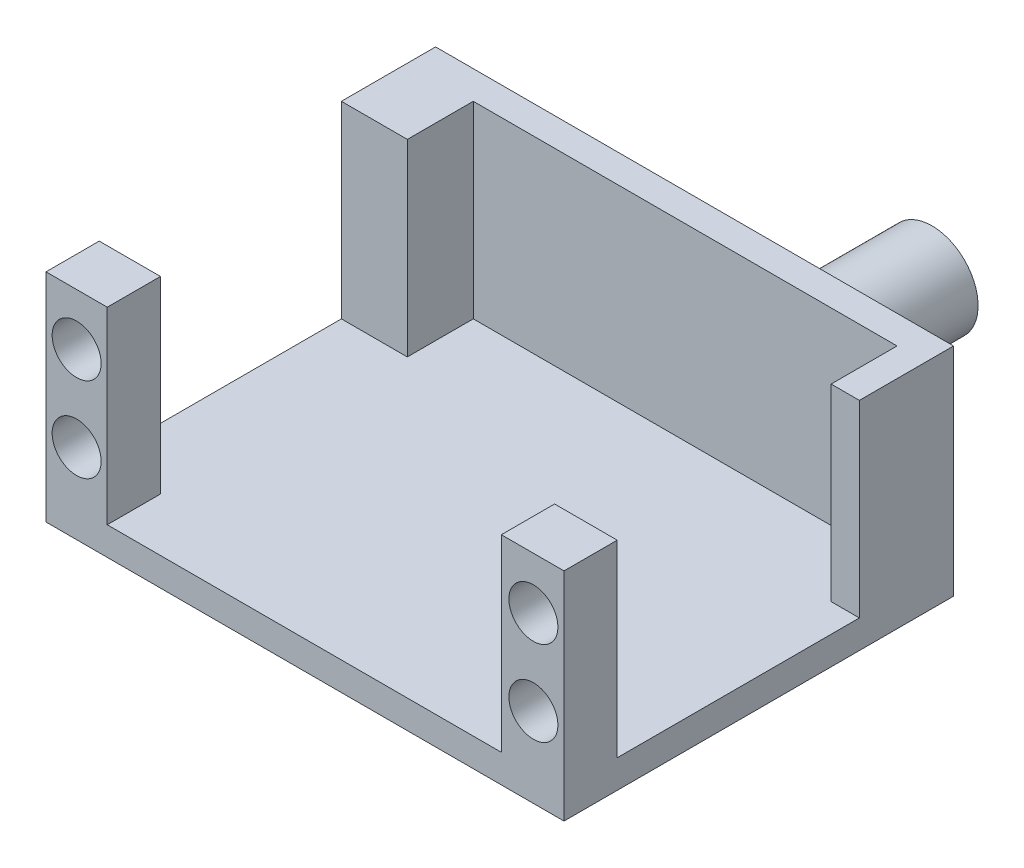
from build123d import *

# Parameters (mm, degrees)
SKETCH1_W           = 54.98
SKETCH1_H           = 41.35
BOSS_EXTRUDE1_DEPTH = 3
SKETCH2_W           = 6.5
SKETCH2_H           = 5.65
SKETCH2_W_2         = 6.65
BOSS_EXTRUDE2_DEPTH = 20
SKETCH3_R           = 4.9
BOSS_EXTRUDE3_DEPTH = 15
CUT_EXTRUDE1_REACH  = 68.783
SKETCH4_R           = 2.6


with BuildPart() as part:
    # Sketch1 → Boss-Extrude1 (new body)
    with BuildSketch(Plane(origin=(0, 0, 0), x_dir=(1, 0, 0), z_dir=(0, 1, 0))):
        with Locations((0, -3)):
            Rectangle(SKETCH1_W, SKETCH1_H)
    extrude(amount=BOSS_EXTRUDE1_DEPTH)

    # Sketch2 → Boss-Extrude2 (add)
    with BuildSketch(Plane(origin=(0, 3, 0), x_dir=(1, 0, 0), z_dir=(0, 1, 0))):
        with Locations((-24.24, -20.85)):
            Rectangle(SKETCH2_W, SKETCH2_H)
        with Locations((24.165, -20.85)):
            Rectangle(SKETCH2_W_2, SKETCH2_H)
        Polygon((-27.49, 17.675), (27.49, 17.675), (27.49, 7.675), (24.49, 7.675), (24.49, 14.675), (-20.49, 14.675), (-20.49, 7.675), (-27.49, 7.675), align=None)
    extrude(amount=BOSS_EXTRUDE2_DEPTH)

    # Sketch3 → Boss-Extrude3 (add)
    with BuildSketch(Plane(origin=(0, 0, -17.675), x_dir=(-1, 0, 0), z_dir=(0, 0, -1))):
        with Locations((-10.19, 13)):
            Circle(SKETCH3_R)
    extrude(amount=BOSS_EXTRUDE3_DEPTH)

    # Sketch4 → Cut-Extrude1 (cut, up to next)
    with BuildSketch(Plane.XY.offset(23.675), mode=Mode.PRIVATE) as cut_extrude1_sk1:
        with Locations((-24.24, 17.5)):
            Circle(SKETCH4_R)
    cut_extrude1_tool1 = extrude(cut_extrude1_sk1.sketch, amount=-CUT_EXTRUDE1_REACH, mode=Mode.PRIVATE) & part.part
    # Sketch4 → Cut-Extrude1 (cut, up to next)
    with BuildSketch(Plane.XY.offset(23.675), mode=Mode.PRIVATE) as cut_extrude1_sk2:
        with Locations((-24.24, 8.5)):
            Circle(SKETCH4_R)
    cut_extrude1_tool2 = extrude(cut_extrude1_sk2.sketch, amount=-CUT_EXTRUDE1_REACH, mode=Mode.PRIVATE) & part.part
    # Sketch4 → Cut-Extrude1 (cut, up to next)
    with BuildSketch(Plane.XY.offset(23.675), mode=Mode.PRIVATE) as cut_extrude1_sk3:
        with Locations((24.24, 17.5)):
            Circle(SKETCH4_R)
    cut_extrude1_tool3 = extrude(cut_extrude1_sk3.sketch, amount=-CUT_EXTRUDE1_REACH, mode=Mode.PRIVATE) & part.part
    # Sketch4 → Cut-Extrude1 (cut, up to next)
    with BuildSketch(Plane.XY.offset(23.675), mode=Mode.PRIVATE) as cut_extrude1_sk4:
        with Locations((24.24, 8.5)):
            Circle(SKETCH4_R)
    cut_extrude1_tool4 = extrude(cut_extrude1_sk4.sketch, amount=-CUT_EXTRUDE1_REACH, mode=Mode.PRIVATE) & part.part
    add(cut_extrude1_tool1.solids().sort_by_distance((-24.24, 17.5, 23.675))[0], mode=Mode.SUBTRACT)
    add(cut_extrude1_tool2.solids().sort_by_distance((-24.24, 8.5, 23.675))[0], mode=Mode.SUBTRACT)
    add(cut_extrude1_tool3.solids().sort_by_distance((24.24, 17.5, 23.675))[0], mode=Mode.SUBTRACT)
    add(cut_extrude1_tool4.solids().sort_by_distance((24.24, 8.5, 23.675))[0], mode=Mode.SUBTRACT)


solid = part.part
